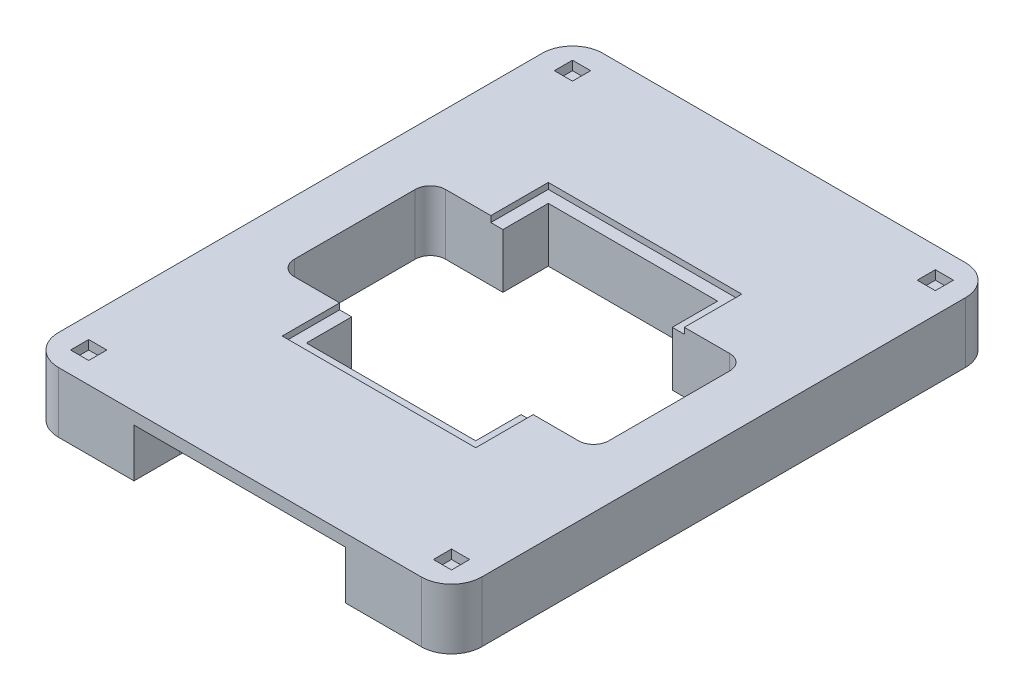
from build123d import *

# Parameters (mm, degrees)
SKETCH_1_W                                 = 200
SKETCH_1_H                                 = 200
EXTRUDE_1_DEPTH                            = 20
SKETCH_2_W                                 = 200
SKETCH_2_H                                 = 200
SKETCH_2_W_2                               = 140
SKETCH_2_H_2                               = 180
CUT_EXTRUDE_2_DEPTH                        = 143.828568571
FILLET_1_R                                 = 10
FILLET_2_R                                 = 10
FILLET_3_R                                 = 10
FILLET_4_R                                 = 10
CUT_EXTRUDE_4_DEPTH                        = 5
MIRROR_3_AT_THE_SECOND_PLANE_COPY_1_DEPTH  = 5
SKETCH_5_R                                 = 5
CUT_EXTRUDE_5_DEPTH                        = 6.2
CUT_EXTRUDE_7_DEPTH                        = 16
SKETCH_8_R                                 = 4.1
CUT_EXTRUDE_8_DEPTH                        = 4
DRAFT_2_ANGLE                              = 10
DRAFT_2_OF_MIRROR_10_2_ANGLE               = 10
DRAFT_2_OF_MIRROR_11_2_ANGLE               = 10
SKETCH_14_W                                = 6
SKETCH_14_H                                = 6
CUT_EXTRUDE_9_DEPTH                        = 3
MIRROR_12_AT_THE_SECOND_PLANE_COPY_1_SKE_W = 6
MIRROR_12_AT_THE_SECOND_PLANE_COPY_1_SKE_H = 6
MIRROR_12_AT_THE_SECOND_PLANE_COPY_1_DEPTH = 3
SKETCH_15_W                                = 64
SKETCH_15_H                                = 88
CUT_EXTRUDE_10_DEPTH                       = 2
SKETCH_16_W                                = 56
SKETCH_16_H                                = 80
CUT_EXTRUDE_11_DEPTH                       = 116.429632244
CUT_EXTRUDE_12_DEPTH                       = 116.758369028


with BuildPart() as part:
    # 草图1 → 凸台-拉伸1 (new body)
    with BuildSketch(Plane(origin=(0, 0, 0), x_dir=(1, 0, 0), z_dir=(0, 1, 0))):
        Rectangle(SKETCH_1_W, SKETCH_1_H)
    extrude(amount=EXTRUDE_1_DEPTH)

    # 草图2 → 切除-拉伸2 (cut, through all)
    with BuildSketch(Plane(origin=(0, 20, 0), x_dir=(1, 0, 0), z_dir=(0, 1, 0))):
        Rectangle(SKETCH_2_W, SKETCH_2_H)
        Rectangle(SKETCH_2_W_2, SKETCH_2_H_2, mode=Mode.SUBTRACT)
    extrude(amount=-CUT_EXTRUDE_2_DEPTH, mode=Mode.SUBTRACT)

    # 圆角1
    fillet_1_edges = [part.edges().sort_by_distance(p)[0] for p in [
        (-70, 10, -90),
    ]]
    fillet(fillet_1_edges, radius=FILLET_1_R)

    # 圆角2
    fillet_2_edges = [part.edges().sort_by_distance(p)[0] for p in [
        (70, 10, -90),
    ]]
    fillet(fillet_2_edges, radius=FILLET_2_R)

    # 圆角3
    fillet_3_edges = [part.edges().sort_by_distance(p)[0] for p in [
        (70, 10, 90),
    ]]
    fillet(fillet_3_edges, radius=FILLET_3_R)

    # 圆角4
    fillet_4_edges = [part.edges().sort_by_distance(p)[0] for p in [
        (-70, 10, 90),
    ]]
    fillet(fillet_4_edges, radius=FILLET_4_R)

    # 草图4 → 切除-拉伸4 (cut)
    with BuildSketch(Plane.XZ):
        with BuildLine():
            Line((-59.5, 84.974937186), (-59.5, 86))
            Line((-59.5, 86), (-60.5, 86))
            Line((-60.5, 86), (-60.5, 84.974937186))
            ThreePointArc((-60.5, 84.974937186), (-63.535533906, 83.535533906), (-64.974937186, 80.5))
            Line((-64.974937186, 80.5), (-66, 80.5))
            Line((-66, 80.5), (-66, 79.5))
            Line((-66, 79.5), (-64.974937186, 79.5))
            ThreePointArc((-64.974937186, 79.5), (-63.535533906, 76.464466094), (-60.5, 75.025062814))
            Line((-60.5, 75.025062814), (-60.5, 74))
            Line((-60.5, 74), (-59.5, 74))
            Line((-59.5, 74), (-59.5, 75.025062814))
            ThreePointArc((-59.5, 75.025062814), (-56.464466094, 76.464466094), (-55.025062814, 79.5))
            Line((-55.025062814, 79.5), (-54, 79.5))
            Line((-54, 79.5), (-54, 80.5))
            Line((-54, 80.5), (-55.025062814, 80.5))
            ThreePointArc((-55.025062814, 80.5), (-56.464466094, 83.535533906), (-59.5, 84.974937186))
        make_face()
    cut_extrude_4 = extrude(amount=-CUT_EXTRUDE_4_DEPTH, mode=Mode.SUBTRACT)

    # 镜向3: 切除-拉伸4 across plane
    add(cut_extrude_4.mirror(Plane(origin=(0, 0, 0), x_dir=(0, 0, 1), z_dir=(1, 0, 0))), mode=Mode.SUBTRACT)

    # 镜向3 at the second plane: 切除-拉伸4 across plane
    add(cut_extrude_4.mirror(Plane.XY), mode=Mode.SUBTRACT)

    # 镜向3 at the second plane copy 1 sket → 镜向3 at the second plane copy 1 (cut)
    with BuildSketch(Plane(origin=(0, 0, 0), x_dir=(-1, 0, 0), z_dir=(0, -1, 0))):
        with BuildLine():
            Line((-59.5, 84.974937186), (-59.5, 86))
            Line((-59.5, 86), (-60.5, 86))
            Line((-60.5, 86), (-60.5, 84.974937186))
            ThreePointArc((-60.5, 84.974937186), (-63.535533906, 83.535533906), (-64.974937186, 80.5))
            Line((-64.974937186, 80.5), (-66, 80.5))
            Line((-66, 80.5), (-66, 79.5))
            Line((-66, 79.5), (-64.974937186, 79.5))
            ThreePointArc((-64.974937186, 79.5), (-63.535533906, 76.464466094), (-60.5, 75.025062814))
            Line((-60.5, 75.025062814), (-60.5, 74))
            Line((-60.5, 74), (-59.5, 74))
            Line((-59.5, 74), (-59.5, 75.025062814))
            ThreePointArc((-59.5, 75.025062814), (-56.464466094, 76.464466094), (-55.025062814, 79.5))
            Line((-55.025062814, 79.5), (-54, 79.5))
            Line((-54, 79.5), (-54, 80.5))
            Line((-54, 80.5), (-55.025062814, 80.5))
            ThreePointArc((-55.025062814, 80.5), (-56.464466094, 83.535533906), (-59.5, 84.974937186))
        make_face()
    extrude(amount=-MIRROR_3_AT_THE_SECOND_PLANE_COPY_1_DEPTH, mode=Mode.SUBTRACT)

    # 草图5 → 切除-拉伸5 (cut)
    with BuildSketch(Plane.XZ):
        with Locations(Location((-60, 80, 0), (0, 0, 270))):
            Circle(SKETCH_5_R)
    extrude(amount=-CUT_EXTRUDE_5_DEPTH, mode=Mode.SUBTRACT)

    # 草图7 → 切除-拉伸7 (cut)
    with BuildSketch(Plane.XZ):
        with BuildLine():
            Line((35, 110), (-35, 110))
            Line((-35, 110), (-35, 75))
            ThreePointArc((-35, 75), (-33.535533906, 71.464466094), (-30, 70))
            Line((-30, 70), (30, 70))
            ThreePointArc((30, 70), (33.535533906, 71.464466094), (35, 75))
            Line((35, 75), (35, 110))
        make_face()
    cut_extrude_7 = extrude(amount=-CUT_EXTRUDE_7_DEPTH, mode=Mode.SUBTRACT)

    # 镜向6: 切除-拉伸7 across plane
    add(cut_extrude_7.mirror(Plane.XY), mode=Mode.SUBTRACT)

    # 草图8 → 切除-拉伸8 (cut)
    with BuildSketch(Plane.XZ):
        with Locations(Location((-40.5, 40.5, 0), (0, 0, 270))):
            Circle(SKETCH_8_R)
    cut_extrude_8 = extrude(amount=-CUT_EXTRUDE_8_DEPTH, mode=Mode.SUBTRACT)

    # 拔模2
    draft_2_faces = [part.faces().sort_by_distance(p)[0] for p in [
        (-40.5, 2, 44.6),
    ]]
    draft(draft_2_faces, Plane(origin=(-40.5, 4, 40.5), x_dir=(0, 0, -1), z_dir=(0, -1, 0)), DRAFT_2_ANGLE)

    # 镜向10: 切除-拉伸8 across plane
    add(cut_extrude_8.mirror(Plane(origin=(0, 0, 0), x_dir=(0, 0, 1), z_dir=(1, 0, 0))), mode=Mode.SUBTRACT)

    # 拔模2 of Mirror 10 2
    draft_2_of_mirror_10_2_faces = [part.faces().sort_by_distance(p)[0] for p in [
        (40.5, 2, 44.6),
    ]]
    draft(draft_2_of_mirror_10_2_faces, Plane(origin=(40.5, 4, 40.5), x_dir=(0, 0, -1), z_dir=(0, -1, 0)), DRAFT_2_OF_MIRROR_10_2_ANGLE)

    # 镜向11: 切除-拉伸8 across plane
    add(cut_extrude_8.mirror(Plane.XY), mode=Mode.SUBTRACT)

    # 拔模2 of Mirror 11 2
    draft_2_of_mirror_11_2_faces = [part.faces().sort_by_distance(p)[0] for p in [
        (-40.5, 2, -44.6),
    ]]
    draft(draft_2_of_mirror_11_2_faces, Plane(origin=(-40.5, 4, -40.5), x_dir=(0, 0, 1), z_dir=(0, -1, 0)), DRAFT_2_OF_MIRROR_11_2_ANGLE)

    # 草图14 → 切除-拉伸9 (cut)
    with BuildSketch(Plane(origin=(0, 20, 0), x_dir=(1, 0, 0), z_dir=(0, 1, 0))):
        with Locations((-60, 80)):
            Rectangle(SKETCH_14_W, SKETCH_14_H)
    cut_extrude_9 = extrude(amount=-CUT_EXTRUDE_9_DEPTH, mode=Mode.SUBTRACT)

    # 镜向12: 切除-拉伸9 across plane
    add(cut_extrude_9.mirror(Plane(origin=(0, 0, 0), x_dir=(0, 0, 1), z_dir=(1, 0, 0))), mode=Mode.SUBTRACT)

    # 镜向12 at the second plane: 切除-拉伸9 across plane
    add(cut_extrude_9.mirror(Plane.XY), mode=Mode.SUBTRACT)

    # 镜向12 at the second plane copy 1 ske → 镜向12 at the second plane copy 1 (cut)
    with BuildSketch(Plane(origin=(0, 20, 0), x_dir=(-1, 0, 0), z_dir=(0, 1, 0))):
        with Locations((-60, 80)):
            Rectangle(MIRROR_12_AT_THE_SECOND_PLANE_COPY_1_SKE_W, MIRROR_12_AT_THE_SECOND_PLANE_COPY_1_SKE_H)
    extrude(amount=-MIRROR_12_AT_THE_SECOND_PLANE_COPY_1_DEPTH, mode=Mode.SUBTRACT)

    # 草图15 → 切除-拉伸10 (cut)
    with BuildSketch(Plane(origin=(0, 20, 0), x_dir=(1, 0, 0), z_dir=(0, 1, 0))):
        Rectangle(SKETCH_15_W, SKETCH_15_H)
    extrude(amount=-CUT_EXTRUDE_10_DEPTH, mode=Mode.SUBTRACT)

    # 草图16 → 切除-拉伸11 (cut, through all)
    with BuildSketch(Plane(origin=(0, 18, 0), x_dir=(1, 0, 0), z_dir=(0, 1, 0))):
        Rectangle(SKETCH_16_W, SKETCH_16_H)
    extrude(amount=-CUT_EXTRUDE_11_DEPTH, mode=Mode.SUBTRACT)

    # 草图17 → 切除-拉伸12 (cut, through all)
    with BuildSketch(Plane(origin=(0, 20, 0), x_dir=(1, 0, 0), z_dir=(0, 1, 0))):
        with BuildLine():
            Line((47, -25), (-47, -25))
            ThreePointArc((-47, -25), (-50.535533906, -23.535533906), (-52, -20))
            Line((-52, -20), (-52, 20))
            ThreePointArc((-52, 20), (-50.535533906, 23.535533906), (-47, 25))
            Line((-47, 25), (47, 25))
            ThreePointArc((47, 25), (50.535533906, 23.535533906), (52, 20))
            Line((52, 20), (52, -20))
            ThreePointArc((52, -20), (50.535533906, -23.535533906), (47, -25))
        make_face()
    extrude(amount=-CUT_EXTRUDE_12_DEPTH, mode=Mode.SUBTRACT)


solid = part.part
